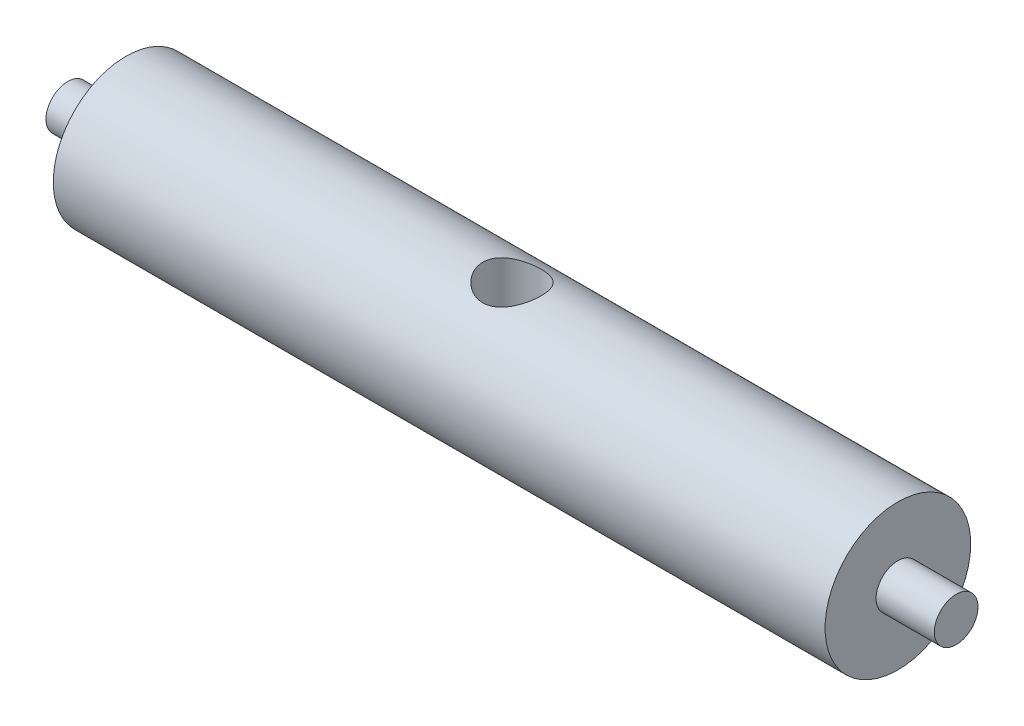
from build123d import *

# Parameters (mm, degrees)
CUT_EXTRUDE1_DEPTH      = 166.158506589
CUT_EXTRUDE1_DEPTH_BACK = 166.158506589
SKETCH2_R               = 10


with BuildPart() as part:
    # Sketch1 → Revolve1 (revolve)
    with BuildSketch(Plane(origin=(0, 0, 0), x_dir=(-1, 0, 0), z_dir=(0, 1, 0)), mode=Mode.PRIVATE) as revolve1_sk:
        Polygon((-161.329886564, 0), (-161.329886564, 7.5), (-141.329886564, 7.5), (-141.329886564, 25), (123.670113436, 25), (123.670113436, 7.5), (143.670113436, 7.5), (143.670113436, 0), align=None)
    revolve(revolve1_sk.sketch.rotate(Axis((170, 0, 0), (-1, 0, 0)), 180), axis=Axis((170, 0, 0), (-1, 0, 0)))

    # Sketch2 → Cut-Extrude1 (cut, two sides: drawn at the far end of the back side and taken through both)
    with BuildSketch(Plane(origin=(0, 0, 0), x_dir=(-1, 0, 0), z_dir=(0, 1, 0)).offset(-CUT_EXTRUDE1_DEPTH_BACK)):
        with Locations(Location((-8.829886564, 0, 0), (0, 0, 90))):
            Circle(SKETCH2_R)
    extrude(amount=CUT_EXTRUDE1_DEPTH + CUT_EXTRUDE1_DEPTH_BACK, mode=Mode.SUBTRACT)


solid = part.part
